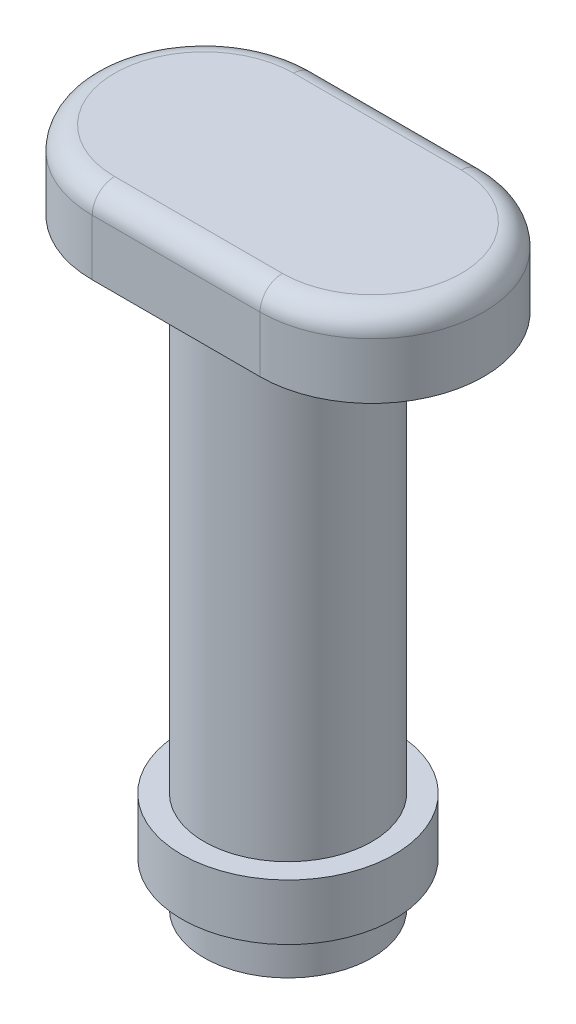
from build123d import *

# Parameters (mm, degrees)
BOSS_EXTRUDE1_DEPTH = 1.4
SKETCH2_R           = 1.5
BOSS_EXTRUDE2_DEPTH = 10
SKETCH3_R           = 1.9
BOSS_EXTRUDE3_DEPTH = 1
FILLET1_R           = 0.4


with BuildPart() as part:
    # Sketch1 → Boss-Extrude1 (new body)
    with BuildSketch(Plane(origin=(0, 0, 0), x_dir=(1, 0, 0), z_dir=(0, 1, 0))):
        with BuildLine():
            Line((-1.5, 2), (1.5, 2))
            ThreePointArc((1.5, 2), (3.5, 0), (1.5, -2))
            Line((1.5, -2), (-1.5, -2))
            ThreePointArc((-1.5, -2), (-3.5, 0), (-1.5, 2))
        make_face()
    extrude(amount=BOSS_EXTRUDE1_DEPTH)

    # Sketch2 → Boss-Extrude2 (add)
    with BuildSketch(Plane(origin=(0, 0, 0), x_dir=(-1, 0, 0), z_dir=(0, -1, 0))):
        with Locations(Location((0, 0, 0), (0, 0, 90))):
            Circle(SKETCH2_R)
    extrude(amount=BOSS_EXTRUDE2_DEPTH)

    # Sketch3 → Boss-Extrude3 (add)
    with BuildSketch(Plane(origin=(0, -9.2, 0), x_dir=(-1, 0, 0), z_dir=(0, -1, 0))):
        with Locations(Location((0, 0, 0), (0, 0, 90))):
            Circle(SKETCH3_R)
    extrude(amount=-BOSS_EXTRUDE3_DEPTH)

    # Fillet1
    fillet1_edges = [part.edges().sort_by_distance(p)[0] for p in [
        (3.5, 1.4, 0),
        (0, 1.4, -2),
        (-3.5, 1.4, 0),
        (0, 1.4, 2),
    ]]
    fillet(fillet1_edges, radius=FILLET1_R)


solid = part.part
